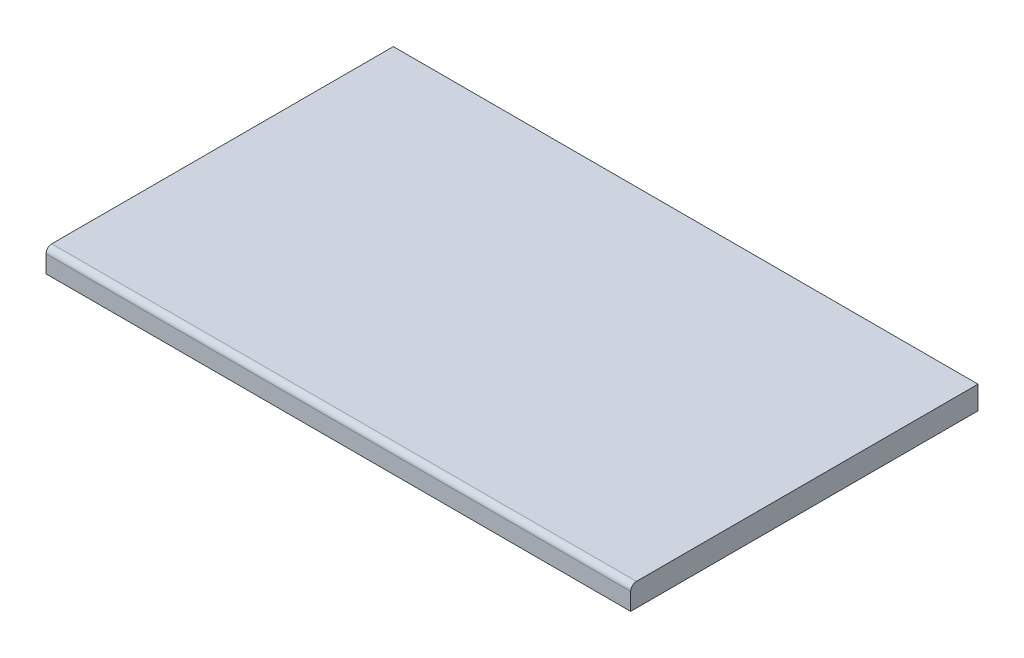
from build123d import *

# Parameters (mm, degrees)
SKETCH1_W           = 1010
SKETCH1_H           = 600
BOSS_EXTRUDE1_DEPTH = 40
FILLET1_R           = 10


with BuildPart() as part:
    # Sketch1 → Boss-Extrude1 (new body)
    with BuildSketch(Plane(origin=(0, 0, 0), x_dir=(1, 0, 0), z_dir=(0, 1, 0))):
        Rectangle(SKETCH1_W, SKETCH1_H)
    extrude(amount=BOSS_EXTRUDE1_DEPTH)

    # Fillet1
    fillet1_edges = [part.edges().sort_by_distance(p)[0] for p in [
        (0, 40, 300),
    ]]
    fillet(fillet1_edges, radius=FILLET1_R)


solid = part.part
